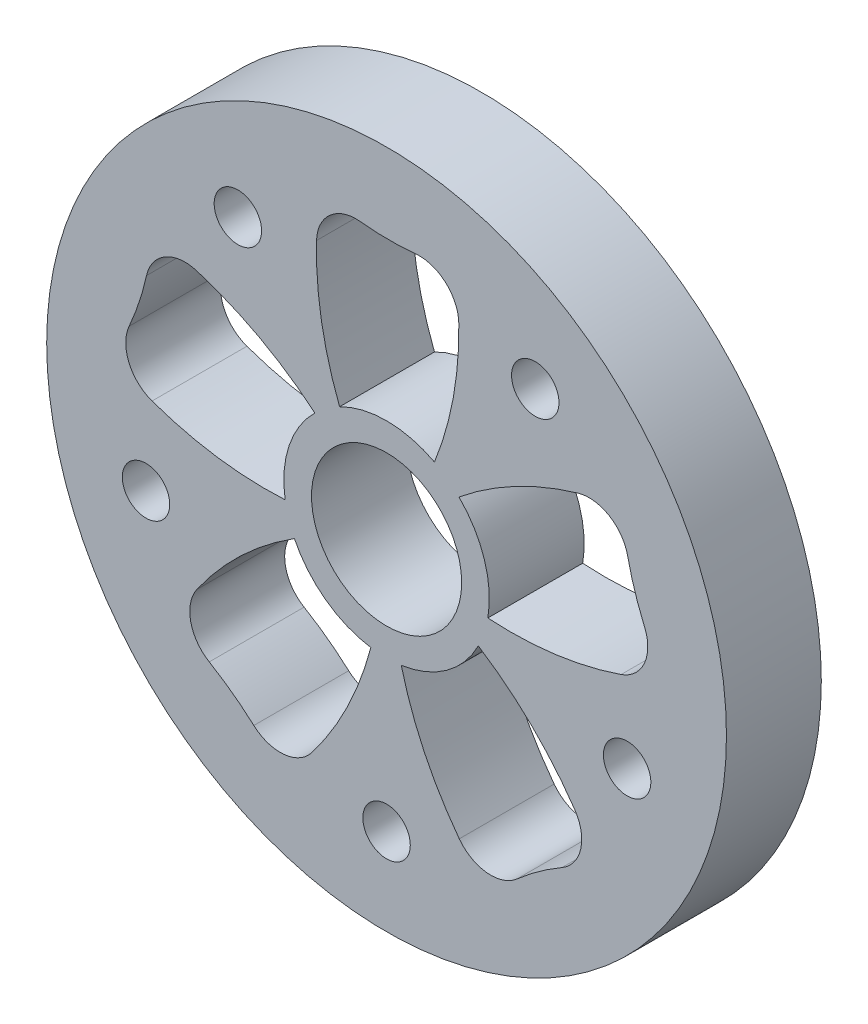
from build123d import *

# Parameters (mm, degrees)
SKETCH_1_R          = 43
SKETCH_1_R_2        = 9.5
SKETCH_1_R_3        = 3
EXTRUDE_1_DEPTH     = 12
CUT_EXTRUDE_1_DEPTH = 62.983868869


with BuildPart() as part:
    # 草图1 → 凸台-拉伸1 (new body)
    with BuildSketch(Plane.XY):
        Circle(SKETCH_1_R)
        Circle(SKETCH_1_R_2, mode=Mode.SUBTRACT)
        with Locations((0, -32)):
            Circle(SKETCH_1_R_3, mode=Mode.SUBTRACT)
        with Locations((-30.433808521, -9.88854382)):
            Circle(SKETCH_1_R_3, mode=Mode.SUBTRACT)
        with Locations((-18.809128073, 25.88854382)):
            Circle(SKETCH_1_R_3, mode=Mode.SUBTRACT)
        with Locations((18.809128073, 25.88854382)):
            Circle(SKETCH_1_R_3, mode=Mode.SUBTRACT)
        with Locations((30.433808521, -9.88854382)):
            Circle(SKETCH_1_R_3, mode=Mode.SUBTRACT)
    extrude(amount=EXTRUDE_1_DEPTH)

    # 草图2 → 切除-拉伸1 (cut, through all)
    with BuildSketch(Plane.XY.offset(12)):
        with BuildLine():
            ThreePointArc((-9.067424527, 9.315675631), (-12.343438055, 4.079158859), (-12.832801935, -2.078267189))
            ThreePointArc((-12.832801935, -2.078267189), (-21.37101475, -1.716157168), (-29.668995358, 0.32730058))
            ThreePointArc((-29.668995358, 0.32730058), (-32.591945887, 3.068256778), (-32.563681076, 7.075210954))
            ThreePointArc((-32.563681076, 7.075210954), (-31.298866838, 10.343394552), (-30.367210921, 13.721677599))
            ThreePointArc((-30.367210921, 13.721677599), (-28.002294185, 16.956434081), (-24.021676007, 17.415955129))
            ThreePointArc((-24.021676007, 17.415955129), (-16.140082755, 14.112519106), (-9.067424527, 9.315675631))
        make_face()
        with BuildLine():
            ThreePointArc((-5.942103436, 11.562500022), (-8.236169203, 19.794721108), (-8.856942422, 28.318032809))
            ThreePointArc((-8.856942422, 28.318032809), (-7.153379557, 31.944926002), (-3.33380537, 33.156261505))
            ThreePointArc((-3.33380537, 33.156261505), (0.165271032, 32.963275955), (3.666106648, 33.121165398))
            ThreePointArc((3.666106648, 33.121165398), (7.473342341, 31.871590651), (9.140451493, 28.227797607))
            ThreePointArc((9.140451493, 28.227797607), (8.434243395, 19.711139115), (6.057745738, 11.502335266))
            ThreePointArc((6.057745738, 11.502335266), (0.065178486, 12.999836605), (-5.942103436, 11.562500022))
        make_face()
        with BuildLine():
            ThreePointArc((30.503276045, 13.416485596), (31.401009953, 10.029030369), (32.632989436, 6.748328364))
            ThreePointArc((32.632989436, 6.748328364), (32.621073761, 2.741292217), (29.670785702, 0.02978322))
            ThreePointArc((29.670785702, 0.02978322), (21.352731843, -1.930365176), (12.811317288, -2.206841486))
            ThreePointArc((12.811317288, -2.206841486), (12.383720574, 3.955182012), (9.160380047, 9.224285197))
            ThreePointArc((9.160380047, 9.224285197), (16.280782246, 13.949967611), (24.195103905, 17.17420619))
            ThreePointArc((24.195103905, 17.17420619), (28.170914186, 16.674793259), (30.503276045, 13.416485596))
        make_face()
        with BuildLine():
            ThreePointArc((22.185866734, -24.864417397), (19.2416204, -26.764994313), (16.502189978, -28.950469101))
            ThreePointArc((16.502189978, -28.950469101), (12.687589993, -30.177378887), (9.197102544, -28.209390565))
            ThreePointArc((9.197102544, -28.209390565), (4.762470636, -20.904170405), (1.860083786, -12.866238312))
            ThreePointArc((1.860083786, -12.866238312), (7.588381736, -10.55539969), (11.603529654, -5.861578248))
            ThreePointArc((11.603529654, -5.861578248), (18.298245994, -11.173166982), (23.810338997, -17.703789654))
            ThreePointArc((23.810338997, -17.703789654), (24.563962018, -21.639337012), (22.185866734, -24.864417397))
        make_face()
        with BuildLine():
            ThreePointArc((-16.791656334, -28.783540658), (-19.509034547, -26.570706563), (-22.434075141, -24.640702259))
            ThreePointArc((-22.434075141, -24.640702259), (-24.77971191, -21.391938061), (-23.986663732, -17.464145391))
            ThreePointArc((-23.986663732, -17.464145391), (-18.409363119, -10.98912264), (-11.661722286, -5.744931098))
            ThreePointArc((-11.661722286, -5.744931098), (-7.693842741, -10.478777785), (-1.989004331, -12.846939782))
            ThreePointArc((-1.989004331, -12.846939782), (-4.971844287, -20.855364568), (-9.479505121, -28.115749926))
            ThreePointArc((-9.479505121, -28.115749926), (-12.989550761, -30.048639027), (-16.791656334, -28.783540658))
        make_face()
    extrude(amount=-CUT_EXTRUDE_1_DEPTH, mode=Mode.SUBTRACT)


solid = part.part
